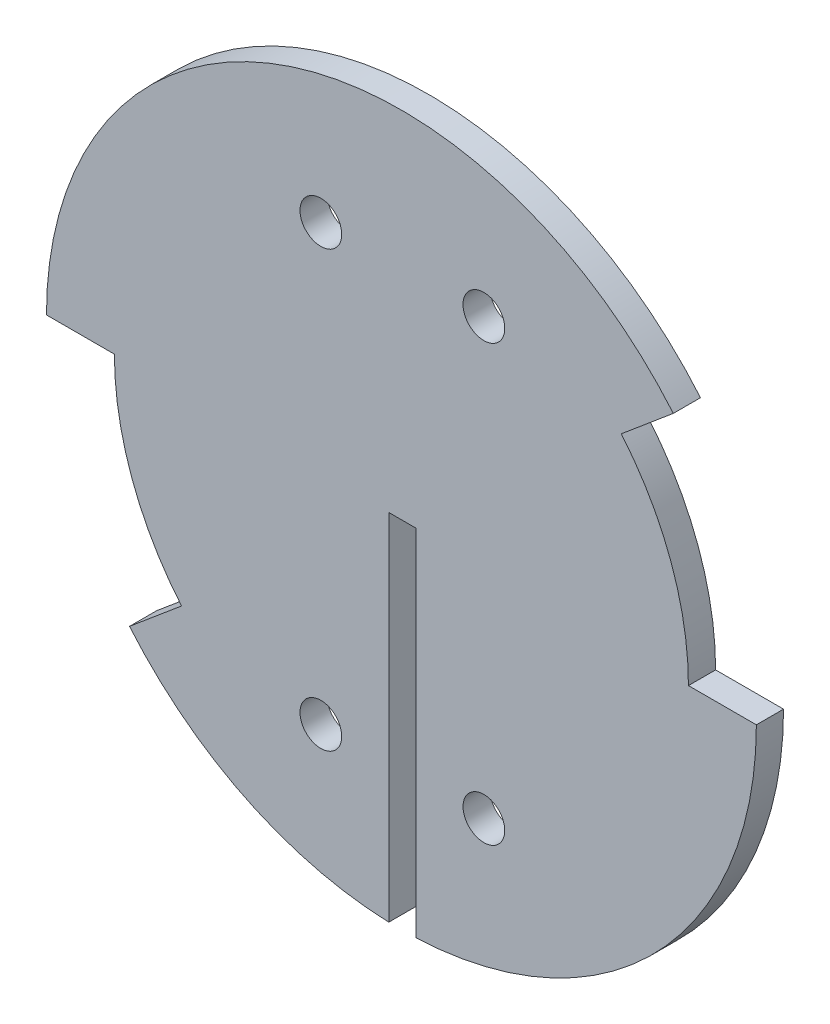
from build123d import *

# Parameters (mm, degrees)
SKETCH1_R           = 66.3575
BOSS_EXTRUDE1_DEPTH = 5.08
CUT_EXTRUDE2_REACH  = 95.981
SKETCH3_R           = 3.900616975
SKETCH3_W           = 5.08
SKETCH3_H           = 67.8815


with BuildPart() as part:
    # Sketch1 → Boss-Extrude1 (new body)
    with BuildSketch(Plane.XY):
        Circle(SKETCH1_R)
    extrude(amount=BOSS_EXTRUDE1_DEPTH)

    # Sketch3 → Cut-Extrude2 (cut, up to next)
    with BuildSketch(Plane.XY, mode=Mode.PRIVATE) as cut_extrude2_sk1:
        with BuildLine():
            Line((-50.832794134, -42.65377881), (-41.104029707, -34.490376167))
            ThreePointArc((-41.104029707, -34.490376167), (-50.4215568, -18.35194584), (-53.6575, 0))
            Line((-53.6575, 0), (-66.3575, 0))
            ThreePointArc((-66.3575, 0), (-62.355653084, -22.695601661), (-50.832794134, -42.65377881))
        make_face()
    cut_extrude2_tool1 = extrude(cut_extrude2_sk1.sketch, amount=CUT_EXTRUDE2_REACH, mode=Mode.PRIVATE) & part.part
    # Sketch3 → Cut-Extrude2 (cut, up to next)
    with BuildSketch(Plane.XY, mode=Mode.PRIVATE) as cut_extrude2_sk2:
        with BuildLine():
            ThreePointArc((50.832794134, 42.65377881), (62.355653084, 22.695601661), (66.3575, 0))
            Line((66.3575, 0), (53.6575, 0))
            ThreePointArc((53.6575, 0), (50.4215568, 18.35194584), (41.104029707, 34.490376167))
            Line((41.104029707, 34.490376167), (50.832794134, 42.65377881))
        make_face()
    cut_extrude2_tool2 = extrude(cut_extrude2_sk2.sketch, amount=CUT_EXTRUDE2_REACH, mode=Mode.PRIVATE) & part.part
    # Sketch3 → Cut-Extrude2 (cut, up to next)
    with BuildSketch(Plane.XY, mode=Mode.PRIVATE) as cut_extrude2_sk3:
        with Locations((15.41807752, -40.64)):
            Circle(SKETCH3_R)
    cut_extrude2_tool3 = extrude(cut_extrude2_sk3.sketch, amount=CUT_EXTRUDE2_REACH, mode=Mode.PRIVATE) & part.part
    # Sketch3 → Cut-Extrude2 (cut, up to next)
    with BuildSketch(Plane.XY, mode=Mode.PRIVATE) as cut_extrude2_sk4:
        with Locations((-15.06192248, -40.64)):
            Circle(SKETCH3_R)
    cut_extrude2_tool4 = extrude(cut_extrude2_sk4.sketch, amount=CUT_EXTRUDE2_REACH, mode=Mode.PRIVATE) & part.part
    # Sketch3 → Cut-Extrude2 (cut, up to next)
    with BuildSketch(Plane.XY, mode=Mode.PRIVATE) as cut_extrude2_sk5:
        with Locations(Location((15.41807752, 40.64, 0), (0, 0, 180))):
            Circle(SKETCH3_R)
    cut_extrude2_tool5 = extrude(cut_extrude2_sk5.sketch, amount=CUT_EXTRUDE2_REACH, mode=Mode.PRIVATE) & part.part
    # Sketch3 → Cut-Extrude2 (cut, up to next)
    with BuildSketch(Plane.XY, mode=Mode.PRIVATE) as cut_extrude2_sk6:
        with Locations(Location((-15.06192248, 40.64, 0), (0, 0, 180))):
            Circle(SKETCH3_R)
    cut_extrude2_tool6 = extrude(cut_extrude2_sk6.sketch, amount=CUT_EXTRUDE2_REACH, mode=Mode.PRIVATE) & part.part
    # Sketch3 → Cut-Extrude2 (cut, up to next)
    with BuildSketch(Plane.XY, mode=Mode.PRIVATE) as cut_extrude2_sk7:
        with Locations((0.17807752, -33.91789821)):
            Rectangle(SKETCH3_W, SKETCH3_H)
    cut_extrude2_tool7 = extrude(cut_extrude2_sk7.sketch, amount=CUT_EXTRUDE2_REACH, mode=Mode.PRIVATE) & part.part
    add(cut_extrude2_tool1.solids().sort_by_distance((-55.456661, -20.184574, 0))[0], mode=Mode.SUBTRACT)
    add(cut_extrude2_tool2.solids().sort_by_distance((55.456661, 20.184574, 0))[0], mode=Mode.SUBTRACT)
    add(cut_extrude2_tool3.solids().sort_by_distance((15.418078, -40.64, 0))[0], mode=Mode.SUBTRACT)
    add(cut_extrude2_tool4.solids().sort_by_distance((-15.061922, -40.64, 0))[0], mode=Mode.SUBTRACT)
    add(cut_extrude2_tool5.solids().sort_by_distance((15.418078, 40.64, 0))[0], mode=Mode.SUBTRACT)
    add(cut_extrude2_tool6.solids().sort_by_distance((-15.061922, 40.64, 0))[0], mode=Mode.SUBTRACT)
    add(cut_extrude2_tool7.solids().sort_by_distance((0.178078, -33.917898, 0))[0], mode=Mode.SUBTRACT)


solid = part.part
